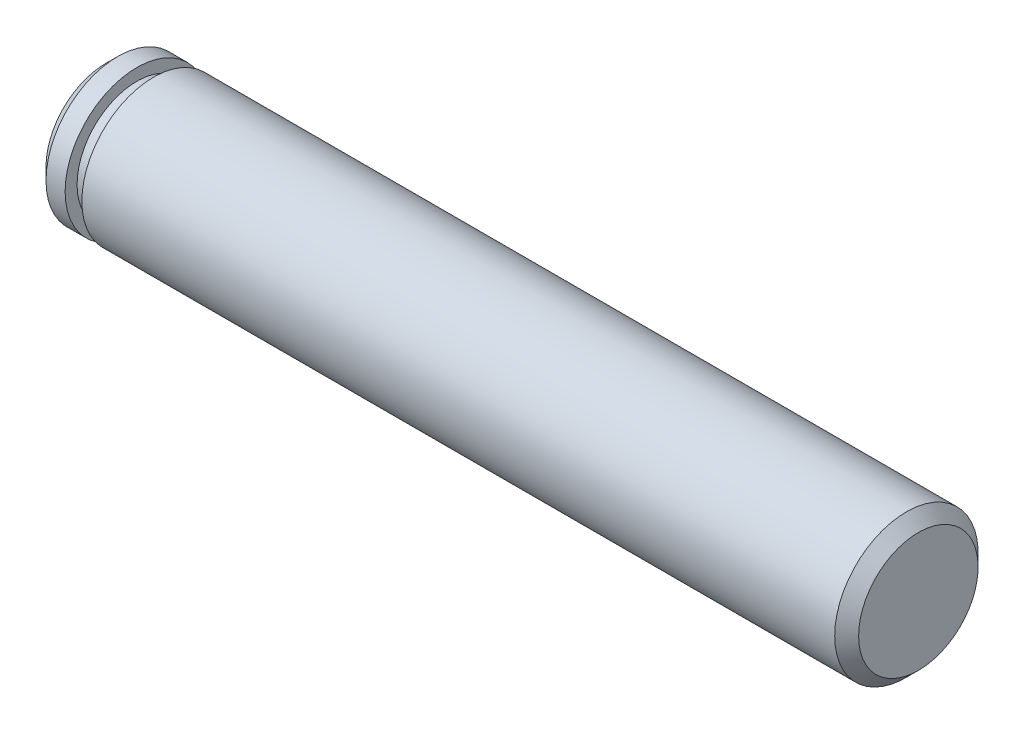
from build123d import *


with BuildPart() as part:
    # Sketch1 → Revolve1 (revolve)
    with BuildSketch(Plane.XY, mode=Mode.PRIVATE) as revolve1_sk:
        Polygon((0, 0), (0, 3), (31.5, 3), (32, 2.5), (32, 0), align=None)
    revolve(revolve1_sk.sketch.rotate(Axis((32, 0, 0), (-1, 0, 0)), 270), axis=Axis((32, 0, 0), (-1, 0, 0)))

    # Sketch2 → Revolve2 (revolve)
    with BuildSketch(Plane.XY, mode=Mode.PRIVATE) as revolve2_sk:
        Polygon((-2, 0), (-2, 2.5), (-1.5, 3), (-0.7, 3), (-0.7, 2.5), (0, 2.5), (0, 0), align=None)
    revolve(revolve2_sk.sketch.rotate(Axis((0, 0, 0), (-1, 0, 0)), 270), axis=Axis((0, 0, 0), (-1, 0, 0)))


solid = part.part
